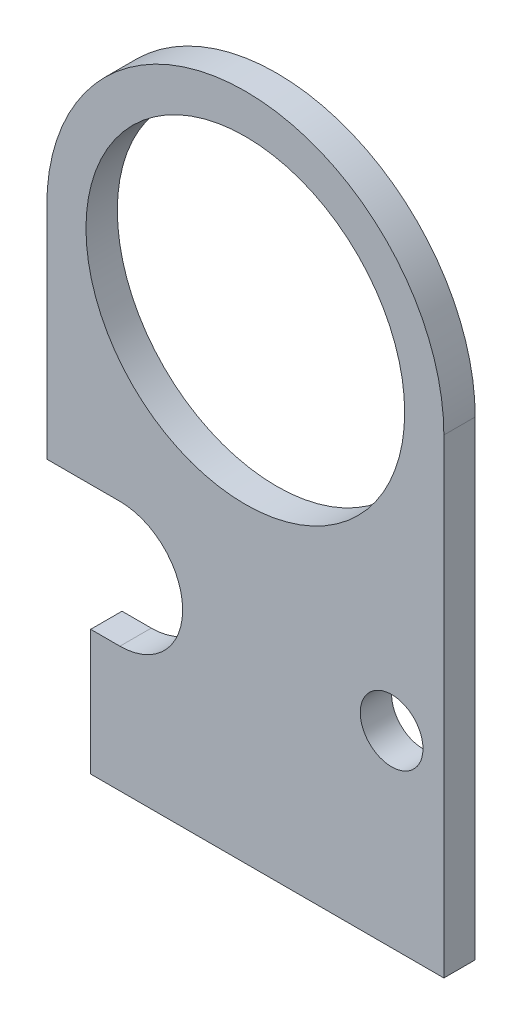
from build123d import *

# Parameters (mm, degrees)
SKETCH1_R           = 2.5
SKETCH1_R_2         = 1.5
BOSS_EXTRUDE1_DEPTH = 3
SKETCH2_R           = 15.25
SKETCH2_R_2         = 3
CUT_EXTRUDE1_DEPTH  = 49.938737213


with BuildPart() as part:
    # Sketch1 → Boss-Extrude1 (new body)
    with BuildSketch(Plane.XY):
        with BuildLine():
            Line((-19, 0), (-19, -32))
            Line((-19, -32), (-14.8, -32))
            Line((-14.8, -32), (-14.8, -45))
            Line((-14.8, -45), (19, -45))
            Line((19, -45), (19, 0))
            ThreePointArc((19, 0), (0, 19), (-19, 0))
        make_face()
        Circle(SKETCH1_R, mode=Mode.SUBTRACT)
        with Locations((-14, -27)):
            Circle(SKETCH1_R_2, mode=Mode.SUBTRACT)
        with Locations(Location((14, -27, 0), (0, 0, 180))):
            Circle(SKETCH1_R_2, mode=Mode.SUBTRACT)
    extrude(amount=BOSS_EXTRUDE1_DEPTH)

    # Sketch2 → Cut-Extrude1 (cut, through all)
    with BuildSketch(Plane.XY.offset(3)):
        Circle(SKETCH2_R)
        with Locations((14, -27)):
            Circle(SKETCH2_R_2)
        with BuildLine():
            Line((-12, -21), (-19, -21))
            Line((-19, -21), (-19, -32))
            Line((-19, -32), (-14.8, -32))
            Line((-14.8, -32), (-14.8, -33))
            Line((-14.8, -33), (-12, -33))
            ThreePointArc((-12, -33), (-6, -27), (-12, -21))
        make_face()
    extrude(amount=-CUT_EXTRUDE1_DEPTH, mode=Mode.SUBTRACT)


solid = part.part
